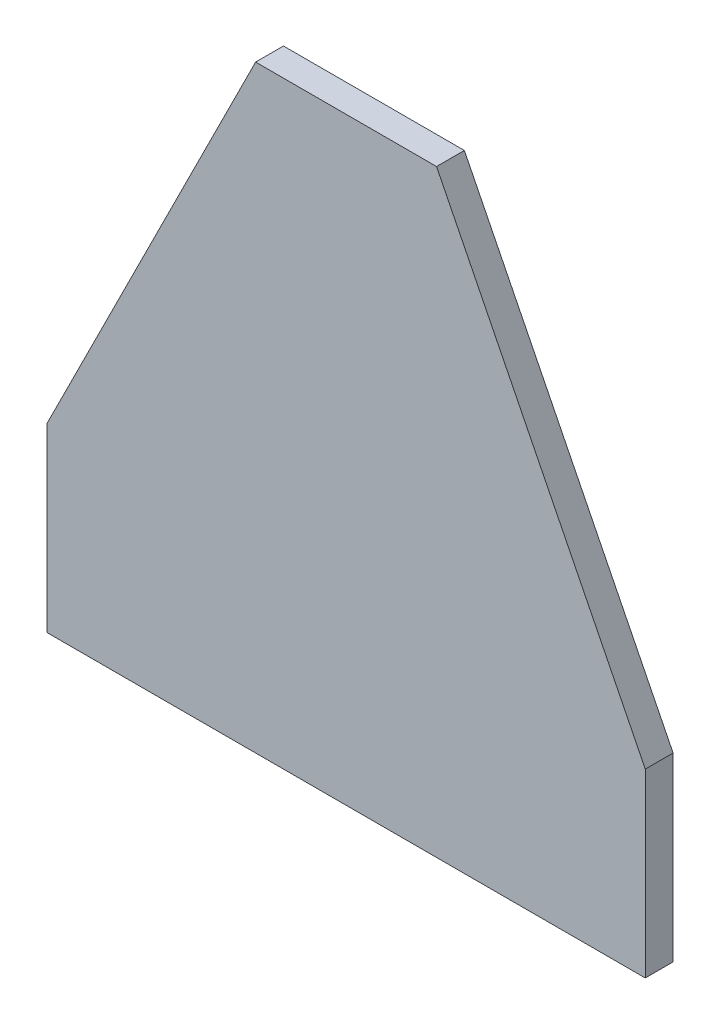
from build123d import *

# Parameters (mm, degrees)
SKETCH1_R           = 7.14375
BOSS_EXTRUDE1_DEPTH = 3.175
BOSS_EXTRUDE3_START = -6.35
SKETCH2_R           = 7.14375
BOSS_EXTRUDE3_DEPTH = 6.35


with BuildPart() as part:
    # Sketch1 → Boss-Extrude1 (new, symmetric)
    with BuildSketch(Plane.XY):
        Polygon((-20.6375, 0), (20.6375, 0), (68.2625, -95.25), (68.2625, -136.525), (-68.2625, -136.525), (-68.2625, -95.25), align=None)
        with Locations((0, -115.8875)):
            Circle(SKETCH1_R, mode=Mode.SUBTRACT)
        with Locations((0, -68.2625)):
            Circle(SKETCH1_R, mode=Mode.SUBTRACT)
        with Locations((0, -20.6375)):
            Circle(SKETCH1_R, mode=Mode.SUBTRACT)
        with Locations((47.625, -115.8875)):
            Circle(SKETCH1_R, mode=Mode.SUBTRACT)
        with Locations((-47.625, -115.8875)):
            Circle(SKETCH1_R, mode=Mode.SUBTRACT)
    extrude(amount=BOSS_EXTRUDE1_DEPTH, both=True)

    # Sketch2 → Boss-Extrude3 (add)
    with BuildSketch(Plane.XY.offset(3.175).offset(BOSS_EXTRUDE3_START)):
        with Locations((0, -68.2625)):
            Circle(SKETCH2_R)
        with Locations((0, -20.6375)):
            Circle(SKETCH2_R)
        with Locations((-47.625, -115.8875)):
            Circle(SKETCH2_R)
        with Locations((0, -115.8875)):
            Circle(SKETCH2_R)
        with Locations((47.625, -115.8875)):
            Circle(SKETCH2_R)
    extrude(amount=BOSS_EXTRUDE3_DEPTH)


solid = part.part
